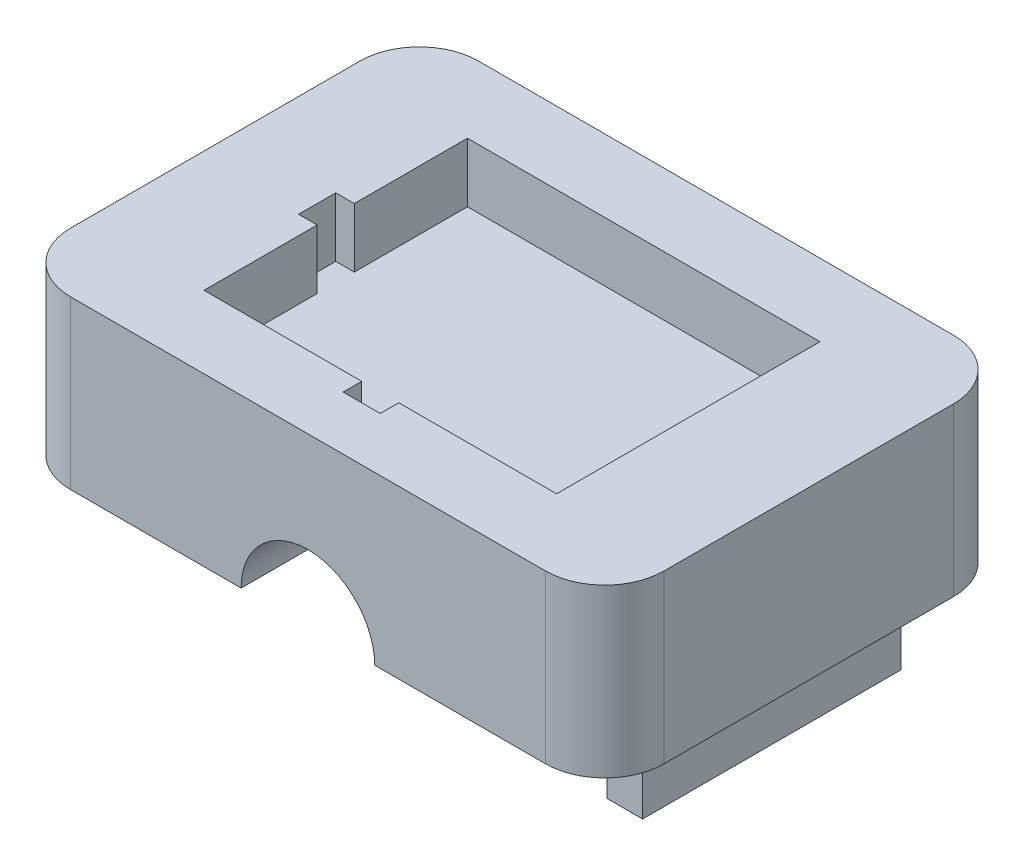
from build123d import *

# Parameters (mm, degrees)
SALIENTE_EXTRUIR1_DEPTH = 55
CROQUIS2_R              = 13.5
CORTAR_EXTRUIR1_DEPTH   = 4.05
CROQUIS3_W              = 4.8
CROQUIS3_H              = 34.8
SALIENTE_EXTRUIR2_DEPTH = 10
REDONDEO1_R             = 8
CORTAR_EXTRUIR2_DEPTH   = 8


with BuildPart() as part:
    # Croquis1 → Saliente-Extruir1 (new body)
    with BuildSketch(Plane.XY):
        with BuildLine():
            Line((-40, 0), (-9, 0))
            ThreePointArc((-9, 0), (0, 9), (9, 0))
            Line((9, 0), (40, 0))
            Line((40, 0), (40, 22.5))
            Line((40, 22.5), (-40, 22.5))
            Line((-40, 22.5), (-40, 0))
        make_face()
    extrude(amount=SALIENTE_EXTRUIR1_DEPTH)

    # Croquis2 → Cortar-Extruir1 (cut, symmetric)
    with BuildSketch(Plane.XY.offset(27.5)):
        Circle(CROQUIS2_R)
    extrude(amount=CORTAR_EXTRUIR1_DEPTH, both=True, mode=Mode.SUBTRACT)

    # Croquis3 → Saliente-Extruir2 (add)
    with BuildSketch(Plane.XZ):
        with Locations((-32.6, 27.5)):
            Rectangle(CROQUIS3_W, CROQUIS3_H)
        with Locations((32.6, 27.5)):
            Rectangle(CROQUIS3_W, CROQUIS3_H)
    extrude(amount=SALIENTE_EXTRUIR2_DEPTH)

    # Redondeo1
    redondeo1_edges = [part.edges().sort_by_distance(p)[0] for p in [
        (40, 11.25, 55),
        (-40, 11.25, 55),
        (-40, 11.25, 0),
        (40, 11.25, 0),
    ]]
    fillet(redondeo1_edges, radius=REDONDEO1_R)

    # Croquis6 → Cortar-Extruir2 (cut)
    with BuildSketch(Plane(origin=(0, 22.5, 0), x_dir=(1, 0, 0), z_dir=(0, 1, 0))):
        Polygon((-23.75, -45.25), (-2.5, -45.25), (-2.5, -47.75), (2.5, -47.75), (2.5, -45.25), (23.75, -45.25), (23.75, -9.75), (-23.75, -9.75), (-23.75, -25), (-26.25, -25), (-26.25, -30), (-23.75, -30), align=None)
    extrude(amount=-CORTAR_EXTRUIR2_DEPTH, mode=Mode.SUBTRACT)


solid = part.part
